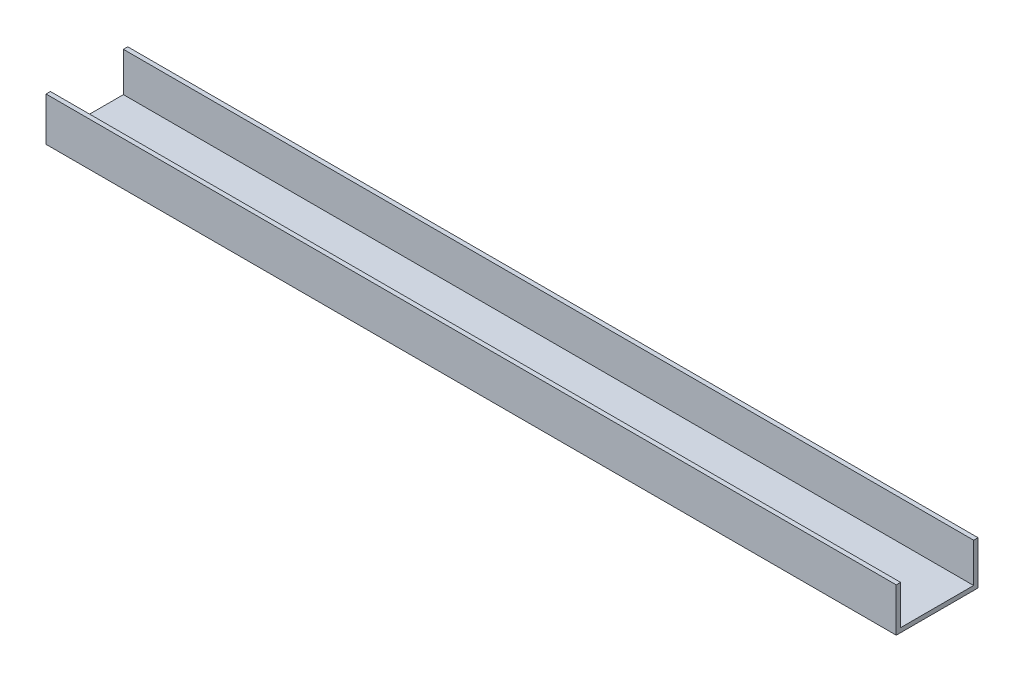
from build123d import *

# Parameters (mm, degrees)
SKETCH_1_W      = 780
SKETCH_1_H      = 75
EXTRUDE_1_DEPTH = 4
SKETCH_2_W      = 780
SKETCH_2_H      = 4
EXTRUDE_2_DEPTH = 36


with BuildPart() as part:
    # 스케치1 → 보스-돌출1 (new body)
    with BuildSketch(Plane(origin=(0, 0, 0), x_dir=(1, 0, 0), z_dir=(0, 1, 0))):
        with Locations((390, 37.5)):
            Rectangle(SKETCH_1_W, SKETCH_1_H)
    extrude(amount=EXTRUDE_1_DEPTH)

    # 스케치2 → 보스-돌출2 (add)
    with BuildSketch(Plane(origin=(0, 4, 0), x_dir=(1, 0, 0), z_dir=(0, 1, 0))):
        with Locations((390, 2)):
            Rectangle(SKETCH_2_W, SKETCH_2_H)
        with Locations((390, 73)):
            Rectangle(SKETCH_2_W, SKETCH_2_H)
    extrude(amount=EXTRUDE_2_DEPTH)


solid = part.part
